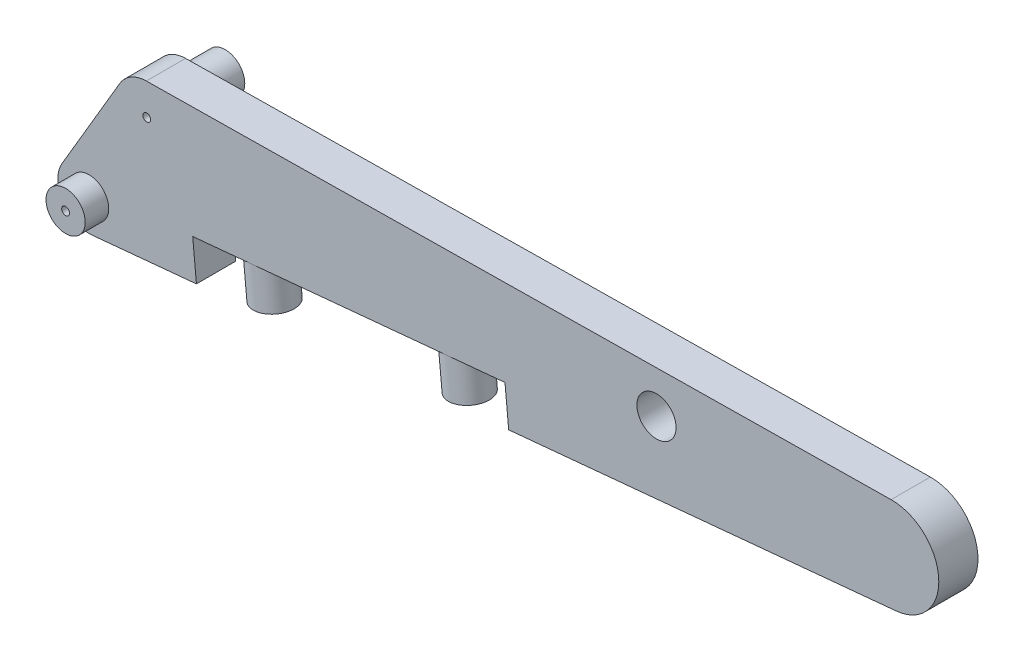
from build123d import *

# Parameters (mm, degrees)
SKETCH3_R           = 2.5
BOSS_EXTRUDE1_DEPTH = 5
BOSS_EXTRUDE2_START = -10
SKETCH4_R           = 2.5
SKETCH4_R_2         = 0.5
BOSS_EXTRUDE2_DEPTH = 10
SKETCH5_R           = 2.5
SKETCH5_R_2         = 0.5
BOSS_EXTRUDE3_DEPTH = 8
SKETCH6_R           = 2.5
CUT_EXTRUDE1_DEPTH  = 5
CUT_EXTRUDE2_DEPTH  = 5
SKETCH8_R           = 2.5
SKETCH8_R_2         = 0.5
BOSS_EXTRUDE4_DEPTH = 5


with BuildPart() as part:
    # Sketch3 → Boss-Extrude1 (new body)
    with BuildSketch(Plane.XY):
        with BuildLine():
            Line((-10.796759364, -10.47282136), (-3.448273099, 2.027168625))
            ThreePointArc((-3.448273099, 2.027168625), (-2.009227979, 3.458757425), (-0.052769314, 3.99965191))
            Line((-0.052769314, 3.99965191), (94.920846029, 5.252684082))
            ThreePointArc((94.920846029, 5.252684082), (100.991235941, -0.422614971), (95.568662408, -6.719784915))
            Line((95.568662408, -6.719784915), (-6.969377993, -16.481984073))
            ThreePointArc((-6.969377993, -16.481984073), (-10.722275279, -14.648837976), (-10.796759364, -10.47282136))
        make_face()
        with Locations((-7.348486265, -12.499989985)):
            Circle(SKETCH3_R, mode=Mode.SUBTRACT)
        Circle(SKETCH3_R, mode=Mode.SUBTRACT)
    extrude(amount=BOSS_EXTRUDE1_DEPTH)

    # Sketch4 → Boss-Extrude2 (add)
    with BuildSketch(Plane.XY.offset(5).offset(BOSS_EXTRUDE2_START)):
        Circle(SKETCH4_R)
        Circle(SKETCH4_R_2, mode=Mode.SUBTRACT)
    extrude(amount=BOSS_EXTRUDE2_DEPTH)

    # Sketch5 → Boss-Extrude3 (add)
    with BuildSketch(Plane(origin=(0, 0, 0), x_dir=(-1, 0, 0), z_dir=(0, 0, -1))):
        with Locations((7.348486265, -12.499989985)):
            Circle(SKETCH5_R)
        with Locations((7.348486265, -12.499989985)):
            Circle(SKETCH5_R_2, mode=Mode.SUBTRACT)
    extrude(amount=-BOSS_EXTRUDE3_DEPTH)

    # Sketch6 → Cut-Extrude1 (cut)
    with BuildSketch(Plane(origin=(0, 0, 0), x_dir=(-1, 0, 0), z_dir=(0, 0, -1))):
        with Locations((-65, -0.510964167)):
            Circle(SKETCH6_R)
    extrude(amount=-CUT_EXTRUDE1_DEPTH, mode=Mode.SUBTRACT)

    # Sketch7 → Cut-Extrude2 (cut)
    with BuildSketch(Plane(origin=(0, 0, 0), x_dir=(-1, 0, 0), z_dir=(0, 0, -1))):
        Polygon((-46.153415314, -11.42439485), (-6.333474433, -15.215477572), (-5.857446262, -10.215477572), (-45.677387144, -6.42439485), align=None)
    extrude(amount=-CUT_EXTRUDE2_DEPTH, mode=Mode.SUBTRACT)

    # Sketch8 → Boss-Extrude4 (add)
    # profile 1 of 2: a face of its own
    with BuildSketch(Plane(origin=(1.016450353, -10.676367657, 0), x_dir=(0.9954985220336859, 0.09477706805312772, 0), z_dir=(0.09477706805312772, -0.9954985220336859, 0))):
        with Locations(Location((12.362886084, 2.5, 0), (0, 0, 270))):
            Circle(SKETCH8_R)
        with Locations((12.362886084, 2.5)):
            Circle(SKETCH8_R_2, mode=Mode.SUBTRACT)
    # profile 2 of 2: a face of its own
    with BuildSketch(Plane(origin=(1.016450353, -10.676367657, 0), x_dir=(0.9954985220336859, 0.09477706805312772, 0), z_dir=(0.09477706805312772, -0.9954985220336859, 0))):
        with Locations(Location((37.362886084, 2.5, 0), (0, 0, 270))):
            Circle(SKETCH8_R)
        with Locations((37.362886084, 2.5)):
            Circle(SKETCH8_R_2, mode=Mode.SUBTRACT)
    extrude(amount=BOSS_EXTRUDE4_DEPTH)


solid = part.part
